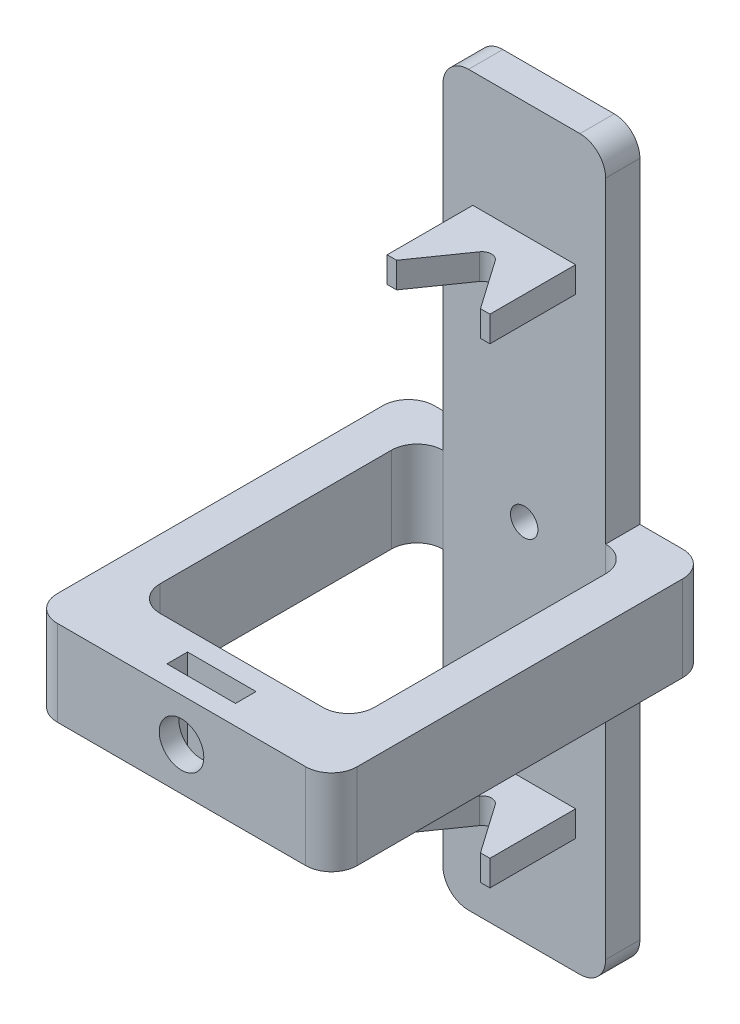
from build123d import *

# Parameters (mm, degrees)
SKETCH1_W           = 15
SKETCH1_H           = 85
BOSS_EXTRUDE1_DEPTH = 4
SKETCH2_W           = 12
SKETCH2_H           = 3
BOSS_EXTRUDE2_DEPTH = 10
CUT_EXTRUDE1_DEPTH  = 60
SKETCH4_R           = 1.6
CUT_EXTRUDE2_DEPTH  = 4
SKETCH5_W           = 10
SKETCH5_H           = 4
BOSS_EXTRUDE3_DEPTH = 50
SKETCH8_W           = 10
SKETCH8_H           = 40
CUT_EXTRUDE3_DEPTH  = 4
SKETCH10_W          = 10
SKETCH10_H          = 10
BOSS_EXTRUDE4_DEPTH = 40
SKETCH11_W          = 7
SKETCH11_H          = 10
BOSS_EXTRUDE5_DEPTH = 15
SKETCH13_W          = 5
SKETCH13_H          = 33
CUT_EXTRUDE4_DEPTH  = 10
CUT_EXTRUDE6_DEPTH  = 7
SKETCH17_W          = 4
SKETCH17_H          = 35
SKETCH17_H_2        = 40
BOSS_EXTRUDE6_DEPTH = 2
SKETCH18_W          = 4
SKETCH18_H          = 35
SKETCH18_H_2        = 40
BOSS_EXTRUDE7_DEPTH = 2
FILLET2_R           = 3
SKETCH19_W          = 4
SKETCH19_H          = 2.4
CUT_EXTRUDE7_DEPTH  = 10


with BuildPart() as part:
    # Sketch1 → Boss-Extrude1 (new body)
    with BuildSketch(Plane.XY):
        Rectangle(SKETCH1_W, SKETCH1_H)
    extrude(amount=BOSS_EXTRUDE1_DEPTH)

    # Sketch2 → Boss-Extrude2 (add)
    with BuildSketch(Plane.XY.offset(4)):
        with Locations((0, 27.5)):
            Rectangle(SKETCH2_W, SKETCH2_H)
        with Locations((0, -27.5)):
            Rectangle(SKETCH2_W, SKETCH2_H)
    extrude(amount=BOSS_EXTRUDE2_DEPTH)

    # Sketch3 → Cut-Extrude1 (cut)
    with BuildSketch(Plane(origin=(0, 29, 0), x_dir=(1, 0, 0), z_dir=(0, 1, 0))):
        with BuildLine():
            Line((0, -7.82217465), (0, -14))
            Line((0, -14), (4.896029025, -14))
            Line((4.896029025, -14), (0.904649293, -8.293404311))
            ThreePointArc((0.904649293, -8.293404311), (0.5100117, -7.947044007), (0, -7.82217465))
        make_face()
        with BuildLine():
            Line((-4.896029025, -14), (0, -14))
            Line((0, -14), (0, -7.82217465))
            ThreePointArc((0, -7.82217465), (-0.5100117, -7.947044007), (-0.904649293, -8.293404311))
            Line((-0.904649293, -8.293404311), (-4.896029025, -14))
        make_face()
    extrude(amount=-CUT_EXTRUDE1_DEPTH, mode=Mode.SUBTRACT)

    # Sketch4 → Cut-Extrude2 (cut)
    with BuildSketch(Plane.XY.offset(4)):
        with Locations((0, -15.4)):
            Circle(SKETCH4_R)
        Circle(SKETCH4_R)
    extrude(amount=-CUT_EXTRUDE2_DEPTH, mode=Mode.SUBTRACT)

    # Sketch5 → Boss-Extrude3 (add)
    with BuildSketch(Plane(origin=(0, 42.5, 0), x_dir=(1, 0, 0), z_dir=(0, 1, 0))):
        with Locations((12.5, -2)):
            Rectangle(SKETCH5_W, SKETCH5_H)
        with Locations((-12.5, -2)):
            Rectangle(SKETCH5_W, SKETCH5_H)
    extrude(amount=-BOSS_EXTRUDE3_DEPTH)

    # Sketch8 → Cut-Extrude3 (cut)
    with BuildSketch(Plane.XY.offset(4)):
        with Locations((12.5, 22.5)):
            Rectangle(SKETCH8_W, SKETCH8_H)
        with Locations((-12.5, 22.5)):
            Rectangle(SKETCH8_W, SKETCH8_H)
    extrude(amount=-CUT_EXTRUDE3_DEPTH, mode=Mode.SUBTRACT)

    # Sketch10 → Boss-Extrude4 (add)
    with BuildSketch(Plane.XY.offset(4)):
        with Locations((12.5, -2.5)):
            Rectangle(SKETCH10_W, SKETCH10_H)
        with Locations((-12.5, -2.5)):
            Rectangle(SKETCH10_W, SKETCH10_H)
    extrude(amount=BOSS_EXTRUDE4_DEPTH)

    # Sketch11 → Boss-Extrude5 (add)
    with BuildSketch(Plane.ZY.offset(-7.5)):
        with Locations((40.5, -2.5)):
            Rectangle(SKETCH11_W, SKETCH11_H)
    extrude(amount=BOSS_EXTRUDE5_DEPTH)

    # Sketch13 → Cut-Extrude4 (cut)
    with BuildSketch(Plane(origin=(0, 2.5, 0), x_dir=(1, 0, 0), z_dir=(0, 1, 0))):
        with Locations((-10, -20.5)):
            Rectangle(SKETCH13_W, SKETCH13_H)
        with Locations((10, -20.5)):
            Rectangle(SKETCH13_W, SKETCH13_H)
    extrude(amount=-CUT_EXTRUDE4_DEPTH, mode=Mode.SUBTRACT)

    # Sketch14 → Cut-Extrude6 (cut)
    with BuildSketch(Plane.XY.offset(44)):
        with BuildLine():
            ThreePointArc((0, 0.1), (-2.6, -2.5), (0, -5.1))
            Line((0, -5.1), (0, 0.1))
        make_face()
        with BuildLine():
            Line((0, 0.1), (0, -5.1))
            ThreePointArc((0, -5.1), (1.838477631, -4.338477631), (2.6, -2.5))
            ThreePointArc((2.6, -2.5), (1.838477631, -0.661522369), (0, 0.1))
        make_face()
    extrude(amount=-CUT_EXTRUDE6_DEPTH, mode=Mode.SUBTRACT)

    # Sketch17 → Boss-Extrude6 (add)
    with BuildSketch(Plane(origin=(7.5, 0, 0), x_dir=(0, 0, -1), z_dir=(1, 0, 0))):
        with Locations((-2, -25)):
            Rectangle(SKETCH17_W, SKETCH17_H)
        with Locations((-2, 22.5)):
            Rectangle(SKETCH17_W, SKETCH17_H_2)
    extrude(amount=BOSS_EXTRUDE6_DEPTH)

    # Sketch18 → Boss-Extrude7 (add)
    with BuildSketch(Plane.ZY.offset(7.5)):
        with Locations((2, -25)):
            Rectangle(SKETCH18_W, SKETCH18_H)
        with Locations((2, 22.5)):
            Rectangle(SKETCH18_W, SKETCH18_H_2)
    extrude(amount=BOSS_EXTRUDE7_DEPTH)

    # Fillet2
    fillet2_edges = [part.edges().sort_by_distance(p)[0] for p in [
        (9.5, -42.5, 2),
        (-9.5, -42.5, 2),
        (9.5, 42.5, 2),
        (-9.5, 42.5, 2),
        (-17.5, -2.5, 0),
        (17.5, -2.5, 44),
        (17.5, -2.5, 0),
        (-17.5, -2.5, 44),
        (12.5, -2.5, 37),
        (-12.5, -2.5, 37),
        (12.5, -2.5, 4),
        (-12.5, -2.5, 4),
    ]]
    fillet(fillet2_edges, radius=FILLET2_R)

    # Sketch19 → Cut-Extrude7 (cut)
    with BuildSketch(Plane(origin=(0, 2.5, 0), x_dir=(1, 0, 0), z_dir=(0, 1, 0))):
        with Locations((-2, -40.5)):
            Rectangle(SKETCH19_W, SKETCH19_H)
        with Locations((2, -40.5)):
            Rectangle(SKETCH19_W, SKETCH19_H)
    extrude(amount=-CUT_EXTRUDE7_DEPTH, mode=Mode.SUBTRACT)


solid = part.part
